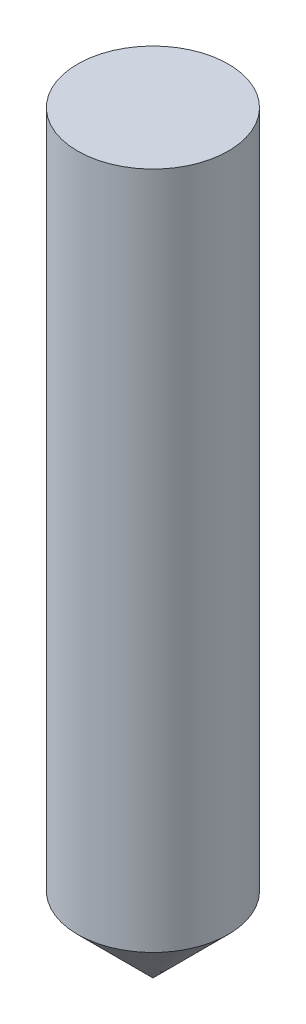
from build123d import *

# Parameters (mm, degrees)
SKETCH1_R           = 5
BOSS_EXTRUDE2_DEPTH = 50
CHAMFER2_SIZE       = 5


with BuildPart() as part:
    # Sketch1 → Boss-Extrude2 (new body)
    with BuildSketch(Plane(origin=(0, 0, 0), x_dir=(1, 0, 0), z_dir=(0, 1, 0))):
        Circle(SKETCH1_R)
    extrude(amount=BOSS_EXTRUDE2_DEPTH)

    # Chamfer2
    chamfer2_edges = [part.edges().sort_by_distance(p)[0] for p in [
        (-5, 0, 0),
    ]]
    chamfer(chamfer2_edges, length=CHAMFER2_SIZE)


solid = part.part
